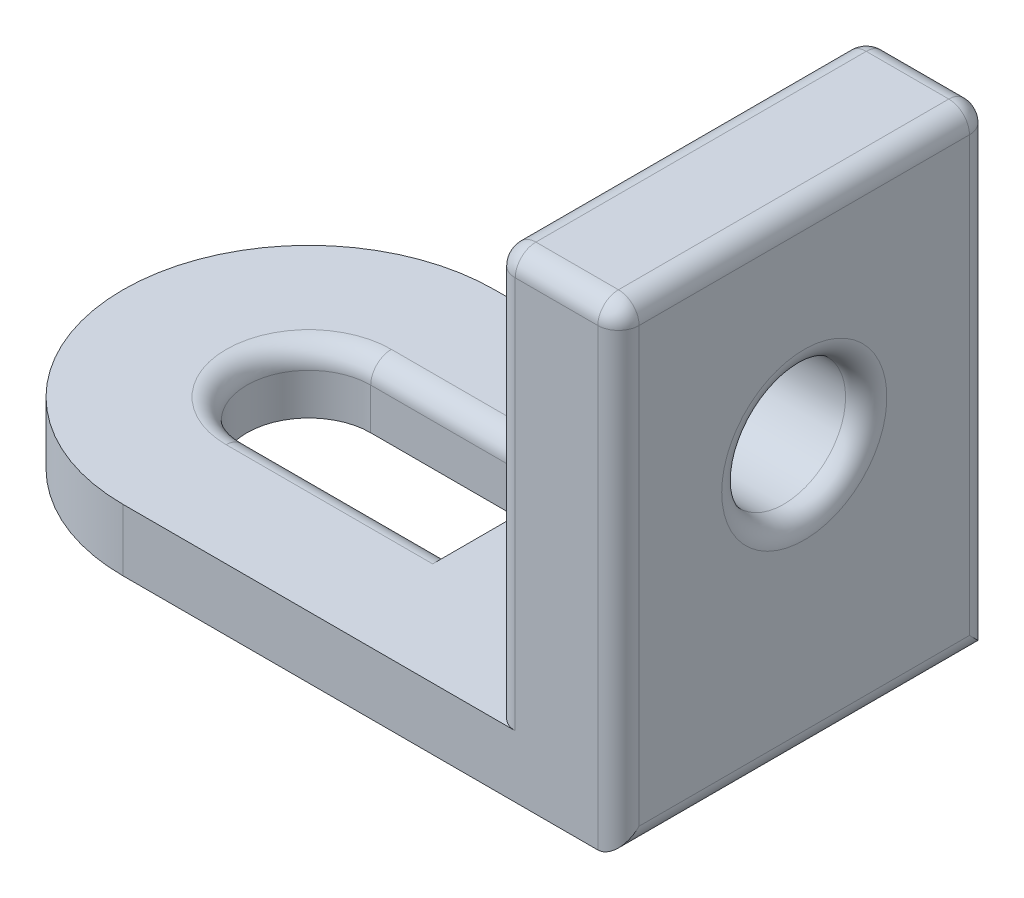
from build123d import *

# Parameters (mm, degrees)
BOSS_EXTRUDE1_DEPTH = 3
CUT_EXTRUDE1_DEPTH  = 3
SKETCH3_W           = 6
SKETCH3_H           = 18
BOSS_EXTRUDE2_DEPTH = 20
FILLET1_R           = 1
FILLET3_R           = 1
FILLET6_R           = 1
SKETCH4_R           = 3
CUT_EXTRUDE2_DEPTH  = 42.218927691
FILLET7_R           = 1


with BuildPart() as part:
    # Sketch1 → Boss-Extrude1 (new body)
    with BuildSketch(Plane(origin=(0, 0, 0), x_dir=(1, 0, 0), z_dir=(0, 1, 0))):
        with BuildLine():
            Line((0, 9), (24, 9))
            Line((24, 9), (24, -9))
            Line((24, -9), (0, -9))
            ThreePointArc((0, -9), (-9, 0), (0, 9))
        make_face()
    extrude(amount=BOSS_EXTRUDE1_DEPTH)

    # Sketch2 → Cut-Extrude1 (cut)
    with BuildSketch(Plane(origin=(0, 3, 0), x_dir=(1, 0, 0), z_dir=(0, 1, 0))):
        with BuildLine():
            Line((0, 3), (10, 3))
            Line((10, 3), (10, -3))
            Line((10, -3), (0, -3))
            ThreePointArc((0, -3), (-3, 0), (0, 3))
        make_face()
    extrude(amount=-CUT_EXTRUDE1_DEPTH, mode=Mode.SUBTRACT)

    # Sketch3 → Boss-Extrude2 (add)
    with BuildSketch(Plane(origin=(0, 3, 0), x_dir=(1, 0, 0), z_dir=(0, 1, 0))):
        with Locations((21, 0)):
            Rectangle(SKETCH3_W, SKETCH3_H)
    extrude(amount=BOSS_EXTRUDE2_DEPTH)

    # Fillet1
    fillet1_edges = [part.edges().sort_by_distance(p)[0] for p in [
        (24, 0, 0),
        (24, 11.5, 9),
        (24, 11.5, -9),
    ]]
    fillet(fillet1_edges, radius=FILLET1_R)

    # Fillet3
    fillet3_edges = [part.edges().sort_by_distance(p)[0] for p in [
        (23.707106781, 23, 8.707106781),
        (23.707106781, 23, -8.707106781),
        (18, 23, 0),
        (20.5, 23, -9),
        (20.5, 23, 9),
        (24, 23, 0),
        (18, 13, 9),
        (18, 13, -9),
    ]]
    fillet(fillet3_edges, radius=FILLET3_R)

    # Fillet6
    fillet6_edges = [part.edges().sort_by_distance(p)[0] for p in [
        (-3, 3, 0),
        (5, 3, 3),
        (5, 3, -3),
    ]]
    fillet(fillet6_edges, radius=FILLET6_R)

    # Sketch4 → Cut-Extrude2 (cut, through all)
    with BuildSketch(Plane(origin=(24, 0, 0), x_dir=(0, 0, -1), z_dir=(1, 0, 0))):
        with Locations((0, 13)):
            Circle(SKETCH4_R)
    extrude(amount=-CUT_EXTRUDE2_DEPTH, mode=Mode.SUBTRACT)

    # Fillet7
    fillet7_edges = [part.edges().sort_by_distance(p)[0] for p in [
        (24, 13, 3),
    ]]
    fillet(fillet7_edges, radius=FILLET7_R)


solid = part.part
